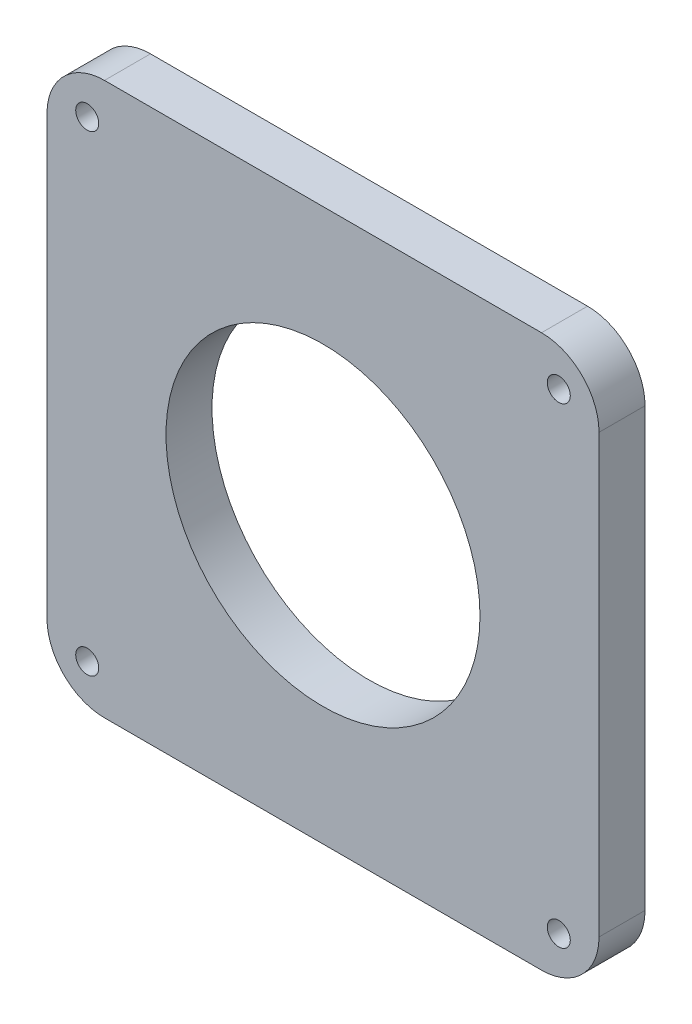
from build123d import *

# Parameters (mm, degrees)
SKETCH1_W           = 96
SKETCH1_H           = 96
BOSS_EXTRUDE1_DEPTH = 0.6
CUT_EXTRUDE1_DEPTH  = 74.6
SKETCH3_R           = 27.3
CUT_EXTRUDE2_DEPTH  = 74.6
SKETCH4_R           = 2
CUT_EXTRUDE3_DEPTH  = 74.6
SKETCH5_R           = 37.3
SKETCH5_R_2         = 27.3
BOSS_EXTRUDE3_DEPTH = 2.5
BOSS_EXTRUDE3_DRAFT = 42
BOSS_EXTRUDE4_START = 7.4
SKETCH8_R           = 27.3
BOSS_EXTRUDE4_DEPTH = 7.4
SKETCH9_R           = 2
CUT_EXTRUDE4_DEPTH  = 137


with BuildPart() as part:
    # Sketch1 → Boss-Extrude1 (new body)
    with BuildSketch(Plane.XY):
        with Locations((48, 48)):
            Rectangle(SKETCH1_W, SKETCH1_H)
    extrude(amount=BOSS_EXTRUDE1_DEPTH)

    # Sketch2 → Cut-Extrude1 (cut)
    with BuildSketch(Plane.XY.offset(0.6)):
        with BuildLine():
            Line((10, 96), (0, 96))
            Line((0, 96), (0, 86))
            ThreePointArc((0, 86), (2.928932188, 93.071067812), (10, 96))
        make_face()
        with BuildLine():
            Line((86, 96), (96, 96))
            Line((96, 96), (96, 86))
            ThreePointArc((96, 86), (93.071067812, 93.071067812), (86, 96))
        make_face()
        with BuildLine():
            Line((86, 0), (96, 0))
            Line((96, 0), (96, 10))
            ThreePointArc((96, 10), (93.071067812, 2.928932188), (86, 0))
        make_face()
        with BuildLine():
            Line((0, 0), (10, 0))
            ThreePointArc((10, 0), (2.928932188, 2.928932188), (0, 10))
            Line((0, 10), (0, 0))
        make_face()
    extrude(amount=-CUT_EXTRUDE1_DEPTH, mode=Mode.SUBTRACT)

    # Sketch3 → Cut-Extrude2 (cut)
    with BuildSketch(Plane.XY.offset(0.6)):
        with Locations((48, 48)):
            Circle(SKETCH3_R)
    extrude(amount=-CUT_EXTRUDE2_DEPTH, mode=Mode.SUBTRACT)

    # Sketch4 → Cut-Extrude3 (cut)
    with BuildSketch(Plane(origin=(0, 0, 0), x_dir=(-1, 0, 0), z_dir=(0, 0, -1))):
        with Locations((-89, 89)):
            Circle(SKETCH4_R)
        with Locations((-7, 89)):
            Circle(SKETCH4_R)
        with Locations((-7, 7)):
            Circle(SKETCH4_R)
        with Locations((-89, 7)):
            Circle(SKETCH4_R)
    extrude(amount=-CUT_EXTRUDE3_DEPTH, mode=Mode.SUBTRACT)


with BuildPart() as boss_extrude3_tool:
    # Sketch5 → Boss-Extrude3 (with draft: the straight prism first)
    with BuildSketch(Plane.XY.offset(0.6)):
        with Locations((48, 48)):
            Circle(SKETCH5_R)
        with Locations((48, 48)):
            Circle(SKETCH5_R_2, mode=Mode.SUBTRACT)
    extrude(amount=BOSS_EXTRUDE3_DEPTH)
    # Boss-Extrude3: the draft: its side faces are tilted about the plane it starts from
    boss_extrude3_sides = [boss_extrude3_tool.faces().sort_by_distance(p)[0] for p in [
        (10.7, 48, 1.85),
        (20.7, 48, 1.85),
    ]]
    draft(boss_extrude3_sides, Plane.XY.offset(0.6), BOSS_EXTRUDE3_DRAFT)


with BuildPart() as part_1:
    add(part.part)

    # Boss-Extrude3: add boss_extrude3_tool
    add(boss_extrude3_tool.part)

    # Sketch8 → Boss-Extrude4 (add)
    with BuildSketch(Plane.XY.offset(0.6).offset(BOSS_EXTRUDE4_START)):
        with BuildLine():
            Line((0, 86), (0, 10))
            ThreePointArc((0, 10), (2.928932188, 2.928932188), (10, 0))
            Line((10, 0), (86, 0))
            ThreePointArc((86, 0), (93.071067812, 2.928932188), (96, 10))
            Line((96, 10), (96, 86))
            ThreePointArc((96, 86), (93.071067812, 93.071067812), (86, 96))
            Line((86, 96), (10, 96))
            ThreePointArc((10, 96), (2.928932188, 93.071067812), (0, 86))
        make_face()
        with Locations((48, 48)):
            Circle(SKETCH8_R, mode=Mode.SUBTRACT)
    extrude(amount=-BOSS_EXTRUDE4_DEPTH)

    # Sketch9 → Cut-Extrude4 (cut, through all)
    with BuildSketch(Plane(origin=(0, 0, 0), x_dir=(-1, 0, 0), z_dir=(0, 0, -1))):
        with Locations((-7, 89)):
            Circle(SKETCH9_R)
        with Locations((-89, 89)):
            Circle(SKETCH9_R)
        with Locations((-89, 7)):
            Circle(SKETCH9_R)
        with Locations((-7, 7)):
            Circle(SKETCH9_R)
    extrude(amount=-CUT_EXTRUDE4_DEPTH, mode=Mode.SUBTRACT)


solid = part_1.part
